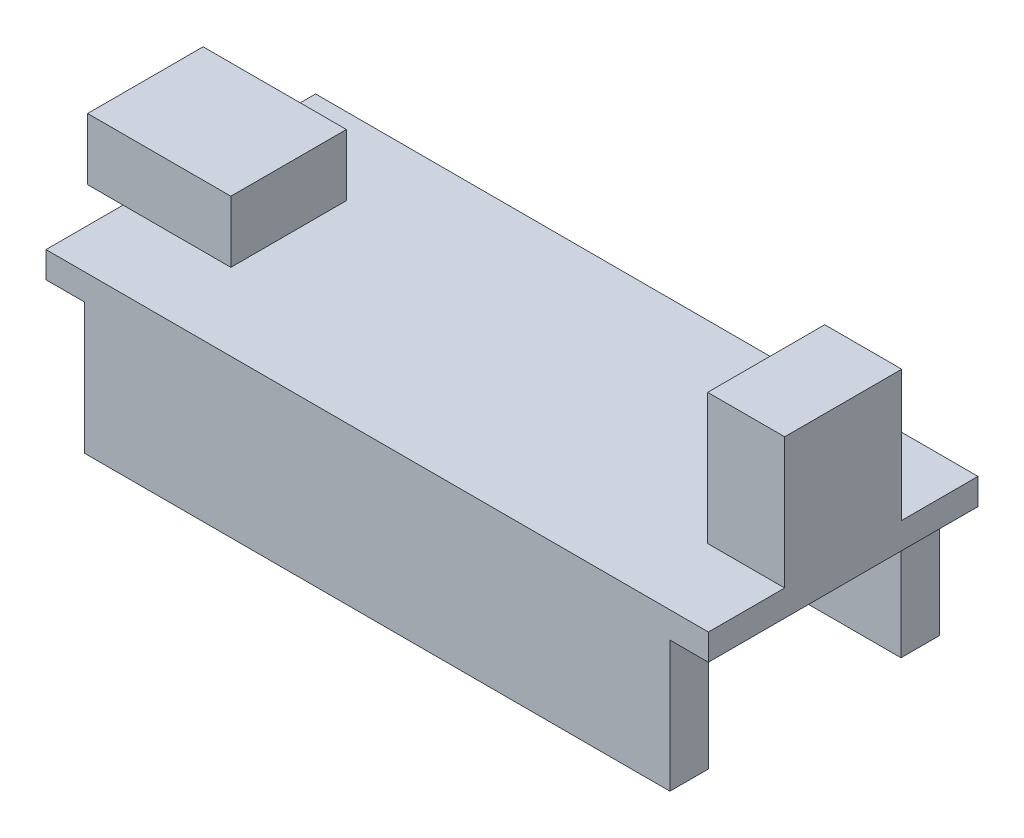
from build123d import *

# Parameters (mm, degrees)
SKETCH_1_W      = 43
SKETCH_1_H      = 17.5
EXTRUDE_1_DEPTH = 1.7
SKETCH_2_W      = 5
SKETCH_2_H      = 7.6
EXTRUDE_2_DEPTH = 8.5
SKETCH_2_3_W    = 9.3
SKETCH_2_3_H    = 7.5
EXTRUDE_3_DEPTH = 4
SKETCH_4_W      = 38
SKETCH_4_H      = 2.5
EXTRUDE_4_DEPTH = 8.5


with BuildPart() as part:
    # Эскиз1 → Бобышка-Вытянуть1 (new body)
    with BuildSketch(Plane(origin=(0, 0, 0), x_dir=(1, 0, 0), z_dir=(0, 1, 0))):
        Rectangle(SKETCH_1_W, SKETCH_1_H)
    extrude(amount=EXTRUDE_1_DEPTH)

    # Эскиз2 → Бобышка-Вытянуть2 (add)
    with BuildSketch(Plane(origin=(0, 1.7, 0), x_dir=(1, 0, 0), z_dir=(0, 1, 0))):
        with Locations((19, 0)):
            Rectangle(SKETCH_2_W, SKETCH_2_H)
    extrude(amount=EXTRUDE_2_DEPTH)

    # Эскиз2<3> → Бобышка-Вытянуть3 (add)
    with BuildSketch(Plane(origin=(0, 1.7, 0), x_dir=(1, 0, 0), z_dir=(0, 1, 0))):
        with Locations((-19.15, 0)):
            Rectangle(SKETCH_2_3_W, SKETCH_2_3_H)
    extrude(amount=EXTRUDE_3_DEPTH)

    # Эскиз4 → Бобышка-Вытянуть4 (add)
    with BuildSketch(Plane.XZ):
        with Locations((0, 7.5)):
            Rectangle(SKETCH_4_W, SKETCH_4_H)
        with Locations((0, -7.5)):
            Rectangle(SKETCH_4_W, SKETCH_4_H)
    extrude(amount=EXTRUDE_4_DEPTH)


solid = part.part
